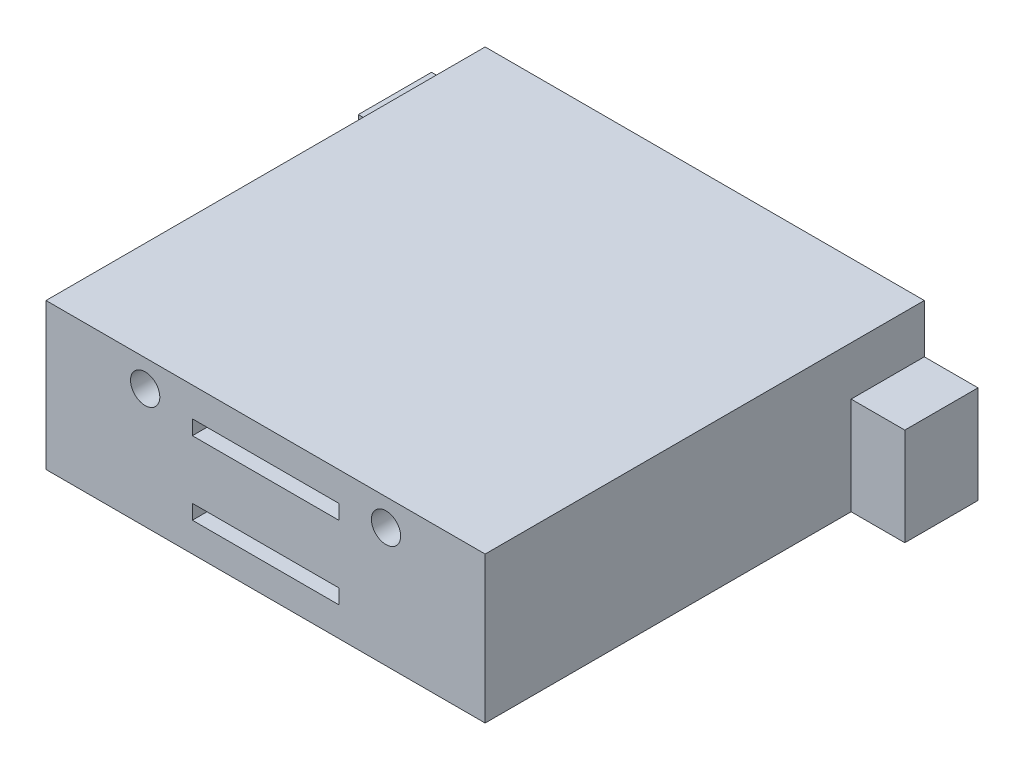
from build123d import *

# Parameters (mm, degrees)
SKETCH1_W           = 90
SKETCH1_H           = 30
BOSS_EXTRUDE1_DEPTH = 90
SKETCH2_W           = 84
SKETCH2_H           = 4
CUT_EXTRUDE1_DEPTH  = 85
SKETCH3_W           = 74
SKETCH3_H           = 3
CUT_EXTRUDE2_DEPTH  = 85
SKETCH4_W           = 84
SKETCH4_H           = 3
CUT_EXTRUDE3_DEPTH  = 85
SKETCH5_W           = 74
SKETCH5_H           = 3
CUT_EXTRUDE4_DEPTH  = 85
SKETCH7_W           = 84
SKETCH7_H           = 4
CUT_EXTRUDE5_DEPTH  = 85
SKETCH8_W           = 74
SKETCH8_H           = 3
CUT_EXTRUDE6_DEPTH  = 85
SKETCH9_W           = 84
SKETCH9_H           = 3
CUT_EXTRUDE7_DEPTH  = 85
SKETCH10_W          = 74
SKETCH10_H          = 3
CUT_EXTRUDE8_DEPTH  = 85
SKETCH11_R          = 3
CUT_EXTRUDE9_DEPTH  = 85
SKETCH12_W          = 30
SKETCH12_H          = 3
CUT_EXTRUDE10_DEPTH = 85
SKETCH13_W          = 15
SKETCH13_H          = 20
BOSS_EXTRUDE2_DEPTH = 11
SKETCH14_R          = 5
CUT_EXTRUDE11_DEPTH = 10


with BuildPart() as part:
    # Sketch1 → Boss-Extrude1 (new body)
    with BuildSketch(Plane.XY):
        with Locations((45, 15)):
            Rectangle(SKETCH1_W, SKETCH1_H)
    extrude(amount=BOSS_EXTRUDE1_DEPTH)

    # Sketch2 → Cut-Extrude1 (cut)
    with BuildSketch(Plane(origin=(0, 0, 0), x_dir=(-1, 0, 0), z_dir=(0, 0, -1))):
        with Locations((-45, 26)):
            Rectangle(SKETCH2_W, SKETCH2_H)
    extrude(amount=-CUT_EXTRUDE1_DEPTH, mode=Mode.SUBTRACT)

    # Sketch3 → Cut-Extrude2 (cut)
    with BuildSketch(Plane(origin=(0, 0, 0), x_dir=(-1, 0, 0), z_dir=(0, 0, -1))):
        with Locations((-45, 22.5)):
            Rectangle(SKETCH3_W, SKETCH3_H)
    extrude(amount=-CUT_EXTRUDE2_DEPTH, mode=Mode.SUBTRACT)

    # Sketch4 → Cut-Extrude3 (cut)
    with BuildSketch(Plane(origin=(0, 0, 0), x_dir=(-1, 0, 0), z_dir=(0, 0, -1))):
        with Locations((-45, 19.5)):
            Rectangle(SKETCH4_W, SKETCH4_H)
    extrude(amount=-CUT_EXTRUDE3_DEPTH, mode=Mode.SUBTRACT)

    # Sketch5 → Cut-Extrude4 (cut)
    with BuildSketch(Plane(origin=(0, 0, 0), x_dir=(-1, 0, 0), z_dir=(0, 0, -1))):
        with Locations((-45, 16.5)):
            Rectangle(SKETCH5_W, SKETCH5_H)
    extrude(amount=-CUT_EXTRUDE4_DEPTH, mode=Mode.SUBTRACT)

    # Sketch7 → Cut-Extrude5 (cut)
    with BuildSketch(Plane(origin=(0, 0, 0), x_dir=(-1, 0, 0), z_dir=(0, 0, -1))):
        with Locations((-45, 13)):
            Rectangle(SKETCH7_W, SKETCH7_H)
    extrude(amount=-CUT_EXTRUDE5_DEPTH, mode=Mode.SUBTRACT)

    # Sketch8 → Cut-Extrude6 (cut)
    with BuildSketch(Plane(origin=(0, 0, 0), x_dir=(-1, 0, 0), z_dir=(0, 0, -1))):
        with Locations((-45, 9.5)):
            Rectangle(SKETCH8_W, SKETCH8_H)
    extrude(amount=-CUT_EXTRUDE6_DEPTH, mode=Mode.SUBTRACT)

    # Sketch9 → Cut-Extrude7 (cut)
    with BuildSketch(Plane(origin=(0, 0, 0), x_dir=(-1, 0, 0), z_dir=(0, 0, -1))):
        with Locations((-45, 6.5)):
            Rectangle(SKETCH9_W, SKETCH9_H)
    extrude(amount=-CUT_EXTRUDE7_DEPTH, mode=Mode.SUBTRACT)

    # Sketch10 → Cut-Extrude8 (cut)
    with BuildSketch(Plane(origin=(0, 0, 0), x_dir=(-1, 0, 0), z_dir=(0, 0, -1))):
        with Locations((-45, 3.5)):
            Rectangle(SKETCH10_W, SKETCH10_H)
    extrude(amount=-CUT_EXTRUDE8_DEPTH, mode=Mode.SUBTRACT)

    # Sketch11 → Cut-Extrude9 (cut)
    with BuildSketch(Plane(origin=(0, 0, 85), x_dir=(-1, 0, 0), z_dir=(0, 0, -1))):
        with Locations((-20.32, 24.51)):
            Circle(SKETCH11_R)
    cut_extrude9 = extrude(amount=-CUT_EXTRUDE9_DEPTH, mode=Mode.SUBTRACT)

    # Mirror1: Cut-Extrude9 across plane
    add(cut_extrude9.mirror(Plane.ZY.offset(-45)), mode=Mode.SUBTRACT)

    # Sketch12 → Cut-Extrude10 (cut)
    with BuildSketch(Plane(origin=(0, 0, 85), x_dir=(-1, 0, 0), z_dir=(0, 0, -1))):
        with Locations((-45, 22.5)):
            Rectangle(SKETCH12_W, SKETCH12_H)
    cut_extrude10 = extrude(amount=-CUT_EXTRUDE10_DEPTH, mode=Mode.SUBTRACT)

    # Mirror2: Cut-Extrude10 across plane
    add(cut_extrude10.mirror(Plane.ZX.offset(15)), mode=Mode.SUBTRACT)

    # Sketch13 → Boss-Extrude2 (add)
    with BuildSketch(Plane.ZY):
        with Locations((7.5, 10)):
            Rectangle(SKETCH13_W, SKETCH13_H)
    boss_extrude2 = extrude(amount=BOSS_EXTRUDE2_DEPTH)

    # Mirror3: Boss-Extrude2 across plane
    add(boss_extrude2.mirror(Plane.ZY.offset(-45)))

    # Sketch14 → Cut-Extrude11 (cut)
    with BuildSketch(Plane(origin=(0, 0, 0), x_dir=(-1, 0, 0), z_dir=(0, 0, -1))):
        with Locations((4, 10)):
            Circle(SKETCH14_R)
    cut_extrude11 = extrude(amount=-CUT_EXTRUDE11_DEPTH, mode=Mode.SUBTRACT)

    # Mirror4: Cut-Extrude11 across plane
    add(cut_extrude11.mirror(Plane.ZY.offset(-45)), mode=Mode.SUBTRACT)


solid = part.part
